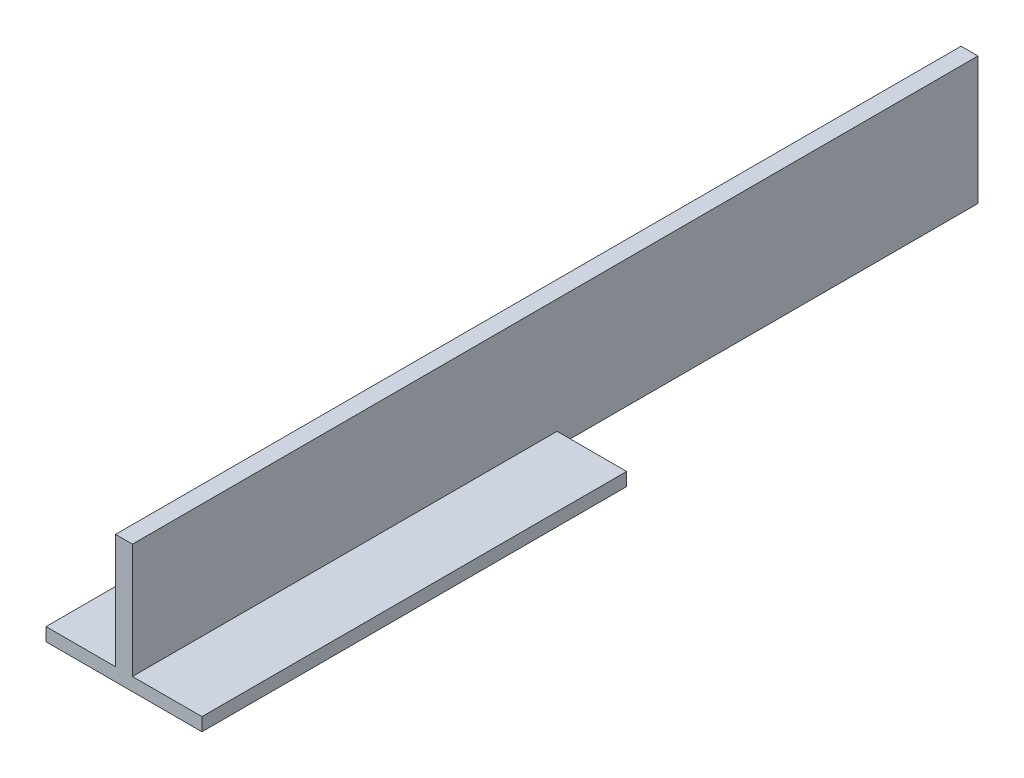
from build123d import *

# Parameters (mm, degrees)
BOSS_EXTRU_1_DEPTH      = 450
ESQUISSE2_W             = 37
ESQUISSE2_H             = 224
ENL_V_MAT_EXTRU_1_DEPTH = 7


with BuildPart() as part:
    # Esquisse1 → Boss.-Extru.1 (new body)
    with BuildSketch(Plane.XY):
        Polygon((0, 0), (83, 0), (83, 7), (46, 7), (46, 68), (37, 68), (37, 7), (0, 7), align=None)
    extrude(amount=BOSS_EXTRU_1_DEPTH)

    # Esquisse2 → Enlèv. mat.-Extru.1 (cut)
    with BuildSketch(Plane(origin=(0, 7, 0), x_dir=(1, 0, 0), z_dir=(0, 1, 0))):
        with Locations((64.5, -112)):
            Rectangle(ESQUISSE2_W, ESQUISSE2_H)
    extrude(amount=-ENL_V_MAT_EXTRU_1_DEPTH, mode=Mode.SUBTRACT)


solid = part.part
